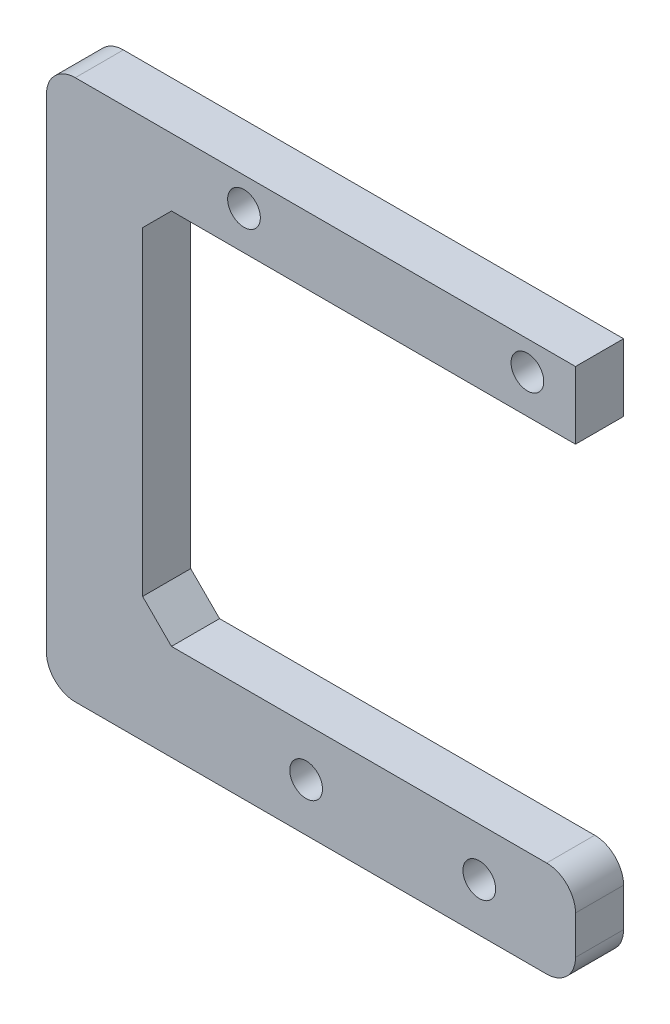
from build123d import *

# Parameters (mm, degrees)
SKETCH_1_R      = 1.7
EXTRUDE_1_DEPTH = 5
FILLET_1_R      = 3
CHAMFER_1_SIZE  = 3


with BuildPart() as part:
    # 草图1 → 凸台-拉伸1 (new body)
    with BuildSketch(Plane.XY):
        Polygon((0, 0), (-55, 0), (-55, 56.2), (0, 56.2), (0, 49.2), (-45, 49.2), (-45, 10), (0, 10), align=None)
        with Locations((-10, 5)):
            Circle(SKETCH_1_R, mode=Mode.SUBTRACT)
        with Locations((-28, 5)):
            Circle(SKETCH_1_R, mode=Mode.SUBTRACT)
        with Locations((-5, 53.2)):
            Circle(SKETCH_1_R, mode=Mode.SUBTRACT)
        with Locations((-34.46, 53.2)):
            Circle(SKETCH_1_R, mode=Mode.SUBTRACT)
    extrude(amount=EXTRUDE_1_DEPTH)

    # 圆角1
    fillet_1_edges = [part.edges().sort_by_distance(p)[0] for p in [
        (0, 0, 2.5),
        (-55, 0, 2.5),
        (-55, 56.2, 2.5),
        (0, 10, 2.5),
    ]]
    fillet(fillet_1_edges, radius=FILLET_1_R)

    # 倒角1
    chamfer_1_edges = [part.edges().sort_by_distance(p)[0] for p in [
        (-45, 49.2, 2.5),
        (-45, 10, 2.5),
    ]]
    chamfer(chamfer_1_edges, length=CHAMFER_1_SIZE)


solid = part.part
